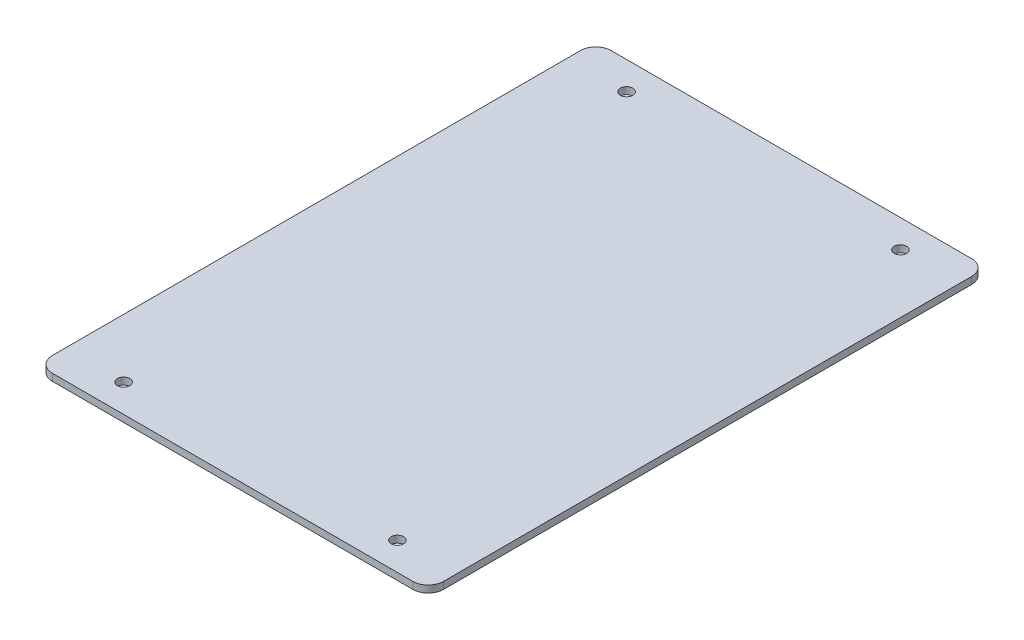
from build123d import *

# Parameters (mm, degrees)
SKETCH1_W                 = 71.12
SKETCH1_H                 = 101.6
BOSS_EXTRUDE1_DEPTH       = 1.27
FILLET1_R                 = 2.794
F_4_40_TAPPED_HOLE1_D     = 2.2606
F_4_40_TAPPED_HOLE1_DEPTH = 2.286
F_4_40_TAPPED_HOLE1_TIP   = 0.679152758


with BuildPart() as part:
    # Sketch1 → Boss-Extrude1 (new body)
    with BuildSketch(Plane(origin=(0, 0, 0), x_dir=(1, 0, 0), z_dir=(0, 1, 0))):
        Rectangle(SKETCH1_W, SKETCH1_H)
    extrude(amount=BOSS_EXTRUDE1_DEPTH)

    # Fillet1
    fillet1_edges = [part.edges().sort_by_distance(p)[0] for p in [
        (35.56, 0.635, 50.8),
        (-35.56, 0.635, 50.8),
        (-35.56, 0.635, -50.8),
        (35.56, 0.635, -50.8),
    ]]
    fillet(fillet1_edges, radius=FILLET1_R)

    # #4-40 Tapped Hole1
    with Locations(Plane(origin=(0, 1.27, 0), x_dir=(1, 0, 0), z_dir=(0, 1, 0))):
        with Locations((-24.892, 45.72), (24.892, 45.72), (-24.892, -45.72), (24.892, -45.72)):
            Hole(F_4_40_TAPPED_HOLE1_D / 2, depth=F_4_40_TAPPED_HOLE1_DEPTH)
            with Locations((0, 0, -(F_4_40_TAPPED_HOLE1_DEPTH + F_4_40_TAPPED_HOLE1_TIP / 2))):  # 118° drill point
                Cone(0, F_4_40_TAPPED_HOLE1_D / 2, F_4_40_TAPPED_HOLE1_TIP, mode=Mode.SUBTRACT)


solid = part.part
